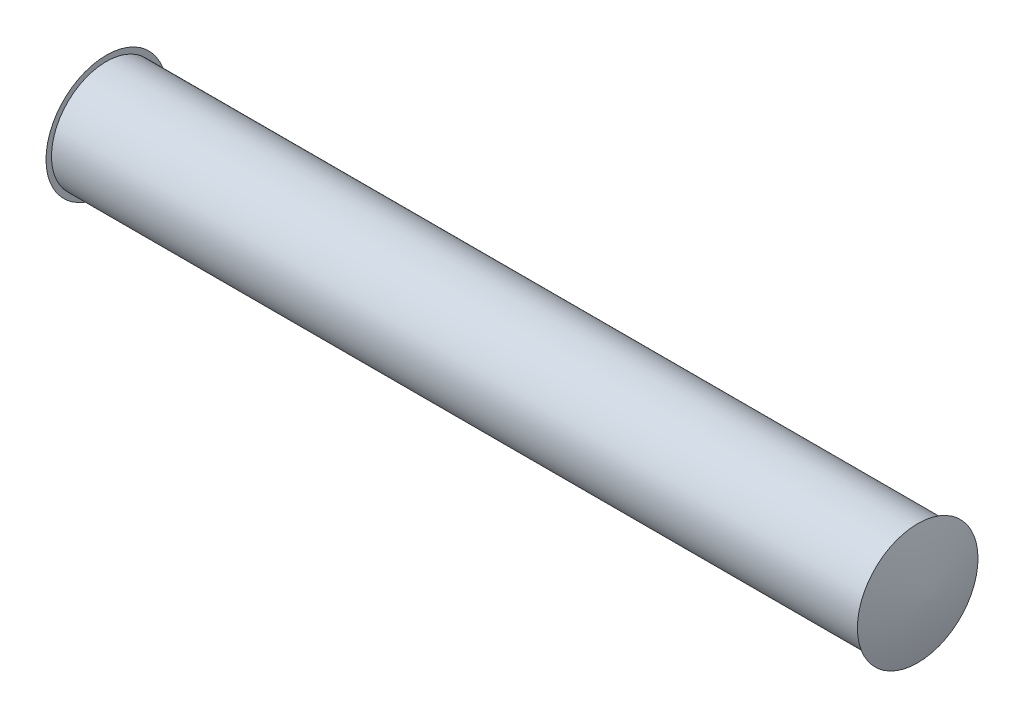
from build123d import *

# Parameters (mm, degrees)
BOSS_EXTRUDE1_DEPTH      = 9.398
BOSS_EXTRUDE1_DEPTH_BACK = 9.398
SKETCH1_R                = 1.27


with BuildPart() as part:
    # Sketch1 → Boss-Extrude1 (new, two sides: drawn at the far end of the back side and taken through both)
    with BuildSketch(Plane(origin=(0, 0, 0), x_dir=(0, 0, -1), z_dir=(1, 0, 0)).offset(-BOSS_EXTRUDE1_DEPTH_BACK)):
        Circle(SKETCH1_R)
    extrude(amount=BOSS_EXTRUDE1_DEPTH + BOSS_EXTRUDE1_DEPTH_BACK)

    # Sketch5 → Revolve1 (revolve)
    with BuildSketch(Plane(origin=(0, 0, 0), x_dir=(1, 0, 0), z_dir=(0, 1, 0))):
        with BuildLine():
            Line((9.398, 0), (9.398, 1.397))
            add(Edge.make_bspline(
                [(9.398, 1.397), (9.613056609, 0.714655059), (9.652, 0)],
                knots=[0, 0, 0, 1, 1, 1], degree=2))
            Line((9.652, 0), (9.398, 0))
        make_face()
    revolve1 = revolve(axis=Axis((9.398, 0, 0), (1, 0, 0)))

    # Mirror1: Revolve1 across plane
    add(revolve1.mirror(Plane(origin=(0, 0, 0), x_dir=(0, 0, 1), z_dir=(1, 0, 0))))


solid = part.part
